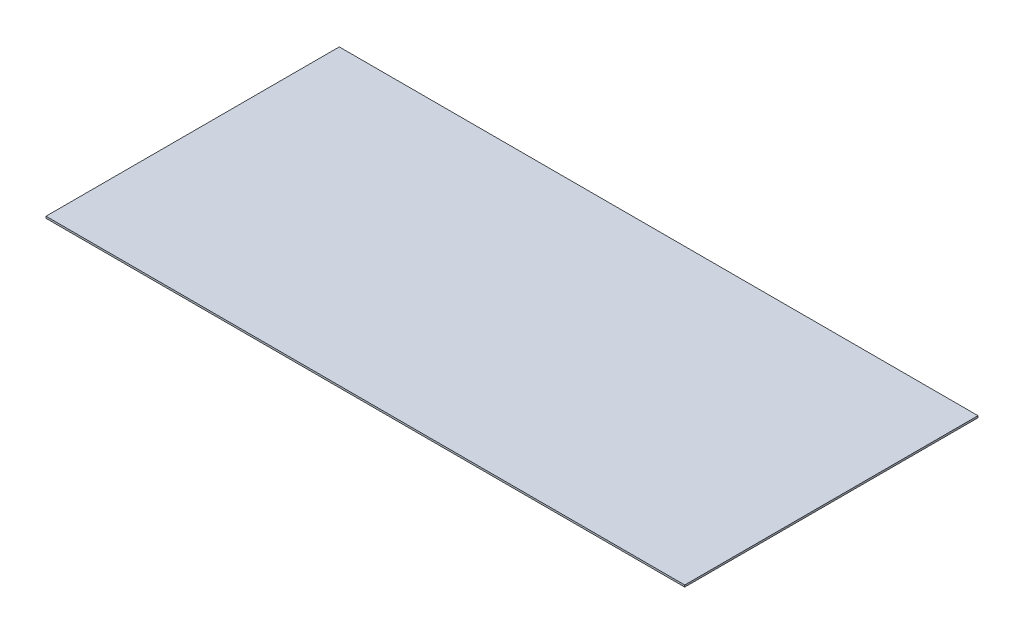
from build123d import *

# Parameters (mm, degrees)
SKETCH1_W           = 1028
SKETCH1_H           = 472
BOSS_EXTRUDE1_DEPTH = 3


with BuildPart() as part:
    # Sketch1 → Boss-Extrude1 (new body)
    with BuildSketch(Plane(origin=(0, 0, 0), x_dir=(1, 0, 0), z_dir=(0, 1, 0))):
        with Locations((-514, -236)):
            Rectangle(SKETCH1_W, SKETCH1_H)
    extrude(amount=BOSS_EXTRUDE1_DEPTH)


solid = part.part
